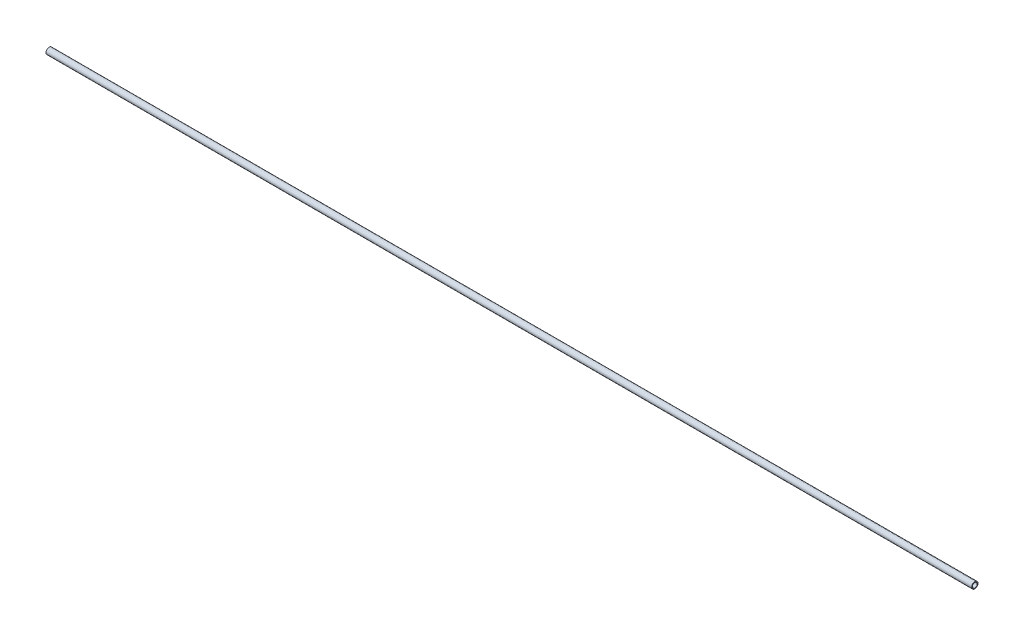
from build123d import *

# Parameters (mm, degrees)
SKETCH1_R           = 12.7
SKETCH1_R_2         = 9.652
BOSS_EXTRUDE1_DEPTH = 3733.8


with BuildPart() as part:
    # Sketch1 → Boss-Extrude1 (new body)
    with BuildSketch(Plane(origin=(0, 0, 0), x_dir=(0, 0, -1), z_dir=(1, 0, 0))):
        Circle(SKETCH1_R)
        Circle(SKETCH1_R_2, mode=Mode.SUBTRACT)
    extrude(amount=BOSS_EXTRUDE1_DEPTH)


solid = part.part
